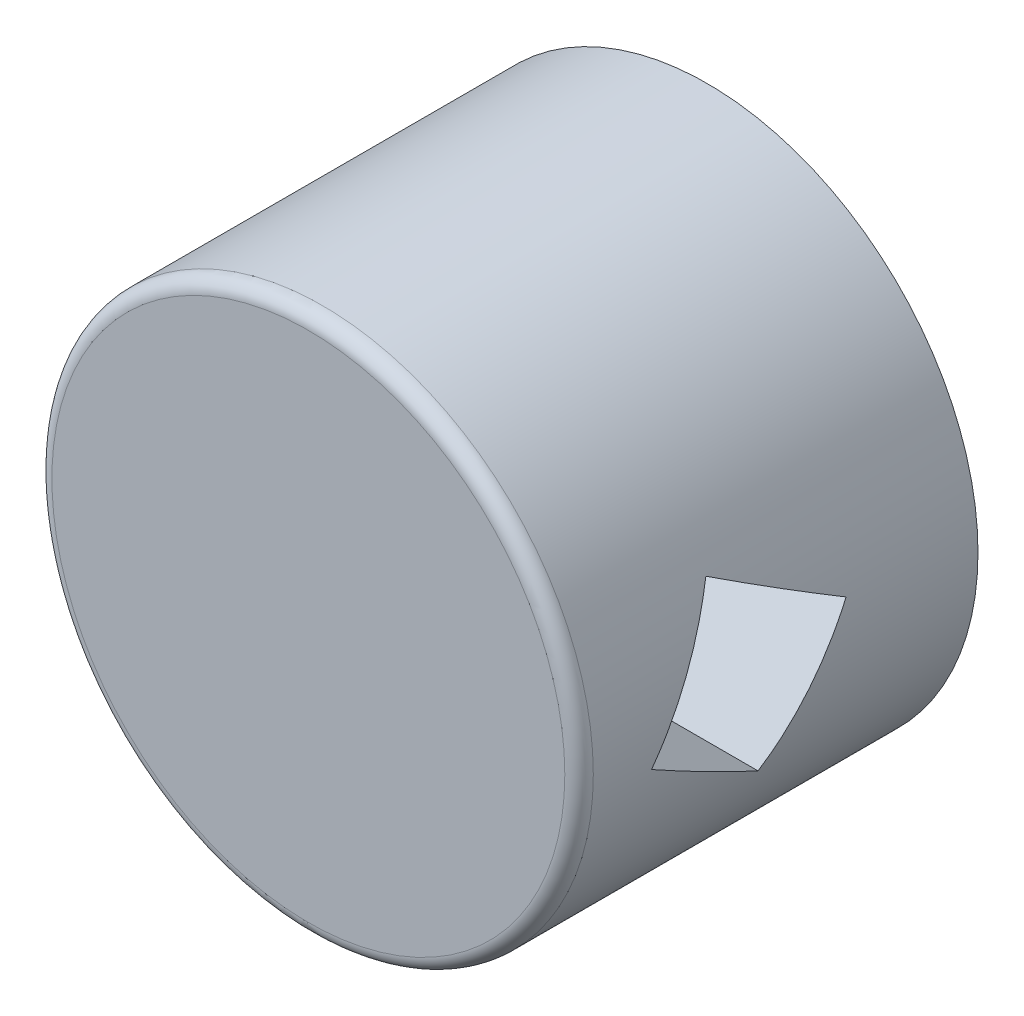
from build123d import *

# Parameters (mm, degrees)
SKETCH1_R                     = 95
BOSS_EXTRUDE1_DEPTH           = 70
SKETCH2_R                     = 80
CUT_EXTRUDE4_DEPTH            = 20
SKETCH5_R                     = 85
CUT_EXTRUDE5_DEPTH            = 10
RACCORDO1_R                   = 5
TAGLIO_ESTRUSIONE1_DEPTH      = 152.492574122
TAGLIO_ESTRUSIONE1_DEPTH_BACK = 152.492574122


with BuildPart() as part:
    # Sketch1 → Boss-Extrude1 (new, symmetric)
    with BuildSketch(Plane.XY):
        Circle(SKETCH1_R)
    extrude(amount=BOSS_EXTRUDE1_DEPTH, both=True)

    # Sketch2 → Cut-Extrude4 (cut)
    with BuildSketch(Plane(origin=(0, 0, -70), x_dir=(-1, 0, 0), z_dir=(0, 0, -1))):
        Circle(SKETCH2_R)
    extrude(amount=-CUT_EXTRUDE4_DEPTH, mode=Mode.SUBTRACT)

    # Sketch5 → Cut-Extrude5 (cut)
    with BuildSketch(Plane(origin=(0, 0, -50), x_dir=(-1, 0, 0), z_dir=(0, 0, -1))):
        Circle(SKETCH5_R)
    extrude(amount=-CUT_EXTRUDE5_DEPTH, mode=Mode.SUBTRACT)

    # Raccordo1
    raccordo1_edges = [part.edges().sort_by_distance(p)[0] for p in [
        (-95, 0, 70),
    ]]
    fillet(raccordo1_edges, radius=RACCORDO1_R)

    # Schizzo2 → Taglio-Estrusione1 (cut, two sides: drawn at the far end of the back side and taken through both)
    with BuildSketch(Plane(origin=(0, 0, 0), x_dir=(0, 0, -1), z_dir=(1, 0, 0)).offset(-TAGLIO_ESTRUSIONE1_DEPTH_BACK)):
        Polygon((24.150635095, 9.150635095), (-19.150635095, 34.150635095), (-44.150635095, -9.150635095), (-0.849364905, -34.150635095), align=None)
    extrude(amount=TAGLIO_ESTRUSIONE1_DEPTH + TAGLIO_ESTRUSIONE1_DEPTH_BACK, mode=Mode.SUBTRACT)


solid = part.part
